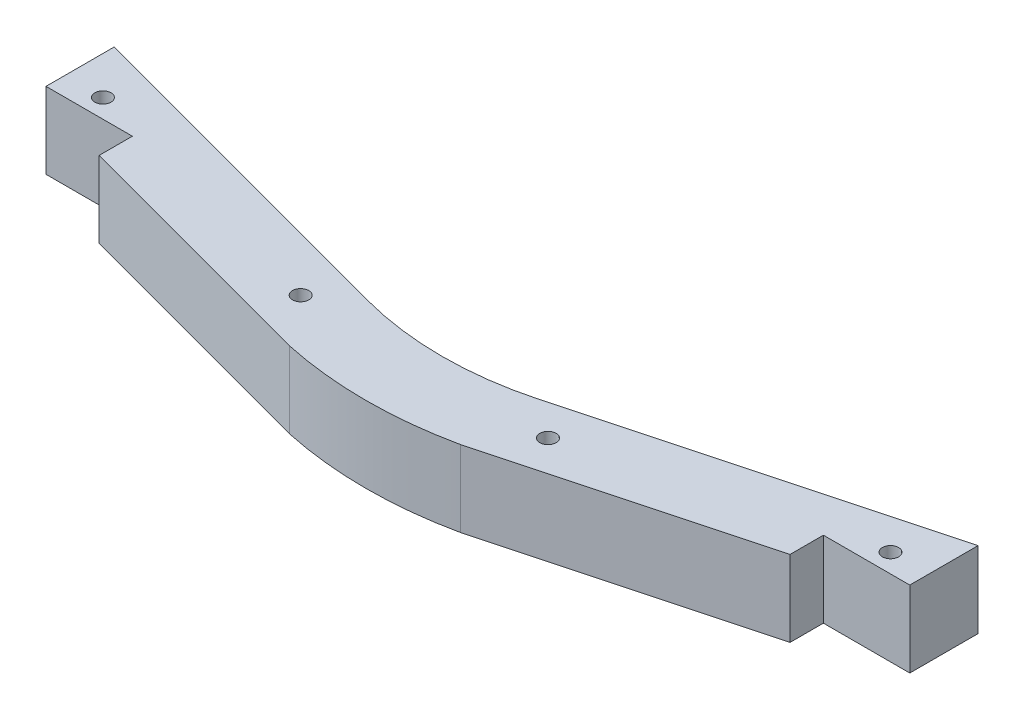
from build123d import *

# Parameters (mm, degrees)
BOSS_EXTRUDE1_DEPTH = 15
SKETCH2_R           = 1.6
BOSS_EXTRUDE2_DEPTH = 15


with BuildPart() as part:
    # Sketch1 → Boss-Extrude1 (new body)
    with BuildSketch(Plane(origin=(0, 0, 0), x_dir=(1, 0, 0), z_dir=(0, 1, 0))):
        with BuildLine():
            ThreePointArc((16.84, -62.837627462), (0, -65.055), (-16.84, -62.837627462))
            Line((-16.84, -62.837627462), (-16.84, -78.263768278))
            ThreePointArc((-16.84, -78.263768278), (0, -80.055), (16.84, -78.263768278))
            Line((16.84, -78.263768278), (16.84, -62.837627462))
        make_face()
    extrude(amount=BOSS_EXTRUDE1_DEPTH)

    # Sketch2 → Boss-Extrude2 (add)
    # profile 1 of 2: a face of its own
    with BuildSketch(Plane(origin=(0, 15, 0), x_dir=(1, 0, 0), z_dir=(0, 1, 0))):
        Polygon((-16.84, -62.837627462), (-84.997835254, -44.574790547), (-84.997835254, -58.000931363), (-67.997835254, -58.000931363), (-67.997835254, -64.556067635), (-16.84, -78.263768278), align=None)
        with Locations(Location((-24.335670508, -68.54223901, 0), (0, 0, 270))):
            Circle(SKETCH2_R, mode=Mode.SUBTRACT)
        with Locations(Location((-77.497835254, -54.297479899, 0), (0, 0, 270))):
            Circle(SKETCH2_R, mode=Mode.SUBTRACT)
    # profile 2 of 2: a face of its own
    with BuildSketch(Plane(origin=(0, 15, 0), x_dir=(1, 0, 0), z_dir=(0, 1, 0))):
        Polygon((84.997835254, -44.574790547), (16.84, -62.837627462), (16.84, -78.263768278), (67.997835254, -64.556067635), (67.997835254, -58.000931363), (84.997835254, -58.000931363), align=None)
        with Locations(Location((24.335670508, -68.54223901, 0), (0, 0, 270))):
            Circle(SKETCH2_R, mode=Mode.SUBTRACT)
        with Locations(Location((77.497835254, -54.297479899, 0), (0, 0, 270))):
            Circle(SKETCH2_R, mode=Mode.SUBTRACT)
    extrude(amount=-BOSS_EXTRUDE2_DEPTH)


solid = part.part
